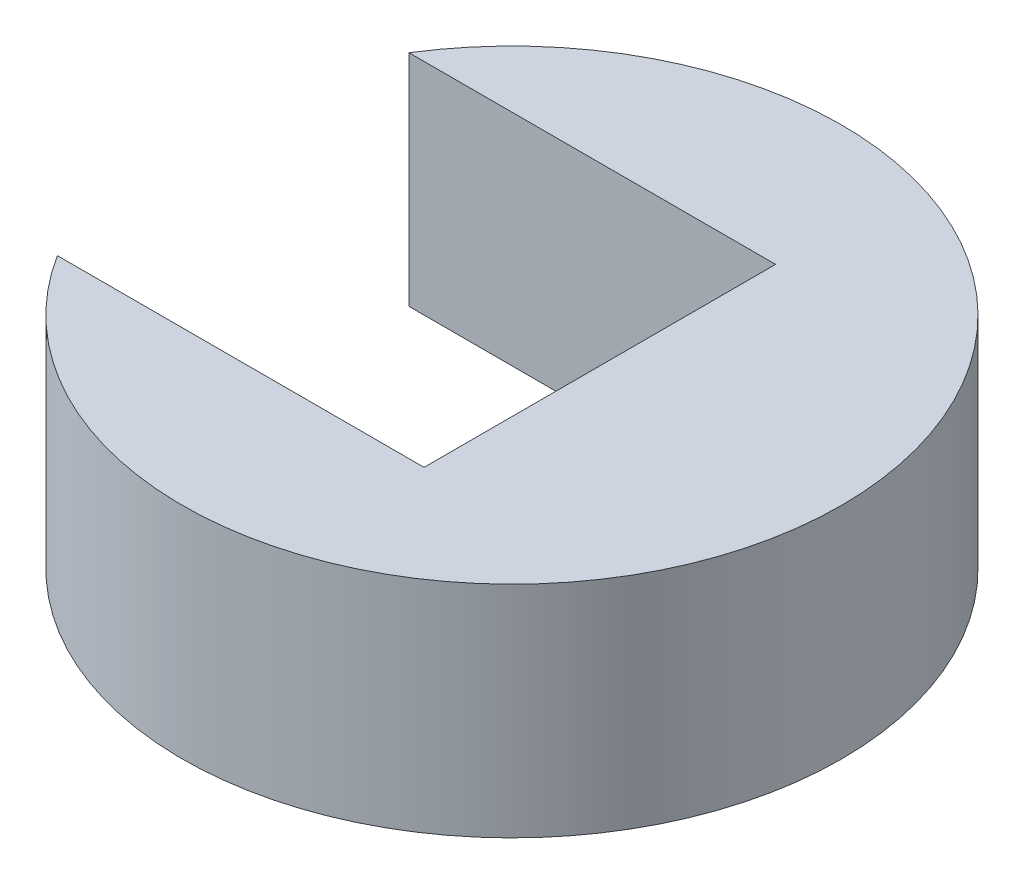
from build123d import *

# Parameters (mm, degrees)
SKETCH1_R           = 15
SKETCH1_R_2         = 7.5
BOSS_EXTRUDE1_DEPTH = 10
SKETCH2_W           = 25
SKETCH2_H           = 16
CUT_EXTRUDE1_DEPTH  = 27.191601707


with BuildPart() as part:
    # Sketch1 → Boss-Extrude1 (new body)
    with BuildSketch(Plane(origin=(0, 0, 0), x_dir=(1, 0, 0), z_dir=(0, 1, 0))):
        with Locations(Location((4, 0, 0), (0, 0, 270))):
            Circle(SKETCH1_R)
        with Locations(Location((0, 0, 0), (0, 0, 270))):
            Circle(SKETCH1_R_2, mode=Mode.SUBTRACT)
    extrude(amount=BOSS_EXTRUDE1_DEPTH)

    # Sketch2 → Cut-Extrude1 (cut, through all)
    with BuildSketch(Plane.XZ):
        with Locations((-4.5, 0)):
            Rectangle(SKETCH2_W, SKETCH2_H)
    extrude(amount=-CUT_EXTRUDE1_DEPTH, mode=Mode.SUBTRACT)


solid = part.part
